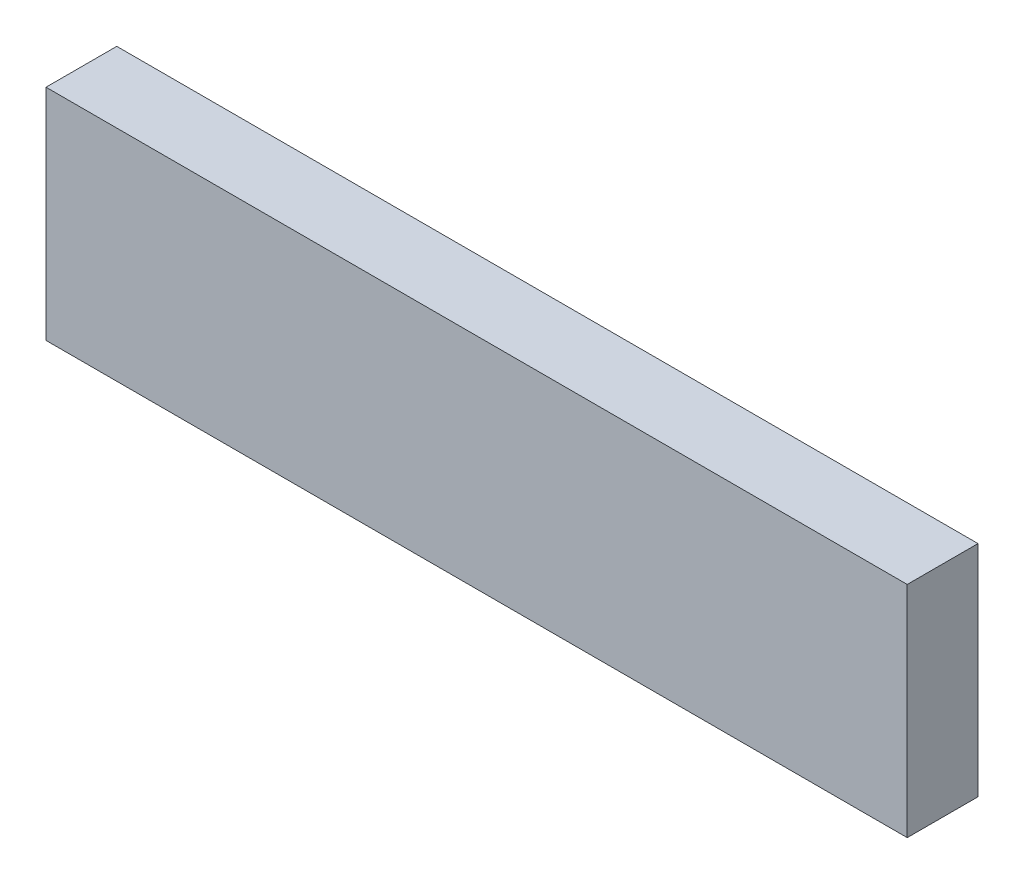
from build123d import *

# Parameters (mm, degrees)
SKETCH1_W               = 12.1691
SKETCH1_H               = 3.0988
COMPONENT_OUTLINE_DEPTH = 1


with BuildPart() as part:
    # Sketch1 → Component_Outline (new body)
    with BuildSketch(Plane.XY):
        with Locations((6.09725, 1.5672)):
            Rectangle(SKETCH1_W, SKETCH1_H)
    extrude(amount=COMPONENT_OUTLINE_DEPTH)


solid = part.part
